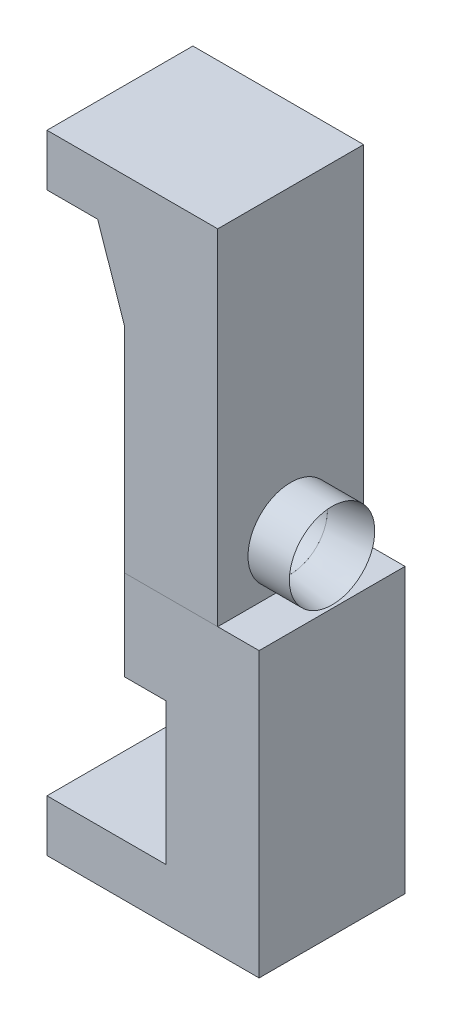
from build123d import *

# Parameters (mm, degrees)
BOSS_EXTRUDE1_DEPTH   = 7.05
BOSS_EXTRUDE1_2_DEPTH = 7.05
SKETCH3_W             = 14.1
SKETCH3_H             = 33.3
BOSS_EXTRUDE7_DEPTH   = 9
SKETCH4_R             = 3.55
CUT_EXTRUDE1_DEPTH    = 9


with BuildPart() as part:
    # Sketch1 → Revolve1 (revolve)
    with BuildSketch(Plane.XY, mode=Mode.PRIVATE) as revolve1_sk:
        Polygon((9, 4.125), (13, 4.125), (9, 3.55), align=None)
    revolve(revolve1_sk.sketch.rotate(Axis((9, 0, 0), (1, 0, 0)), 90), axis=Axis((9, 0, 0), (1, 0, 0)))


with BuildPart() as body_2:
    # Sketch2 → Boss-Extrude1 (new, symmetric)
    with BuildSketch(Plane.XY):
        Polygon((0, -4.425), (13, -4.425), (13, -31.825), (-7.5, -31.825), (-7.5, -26.825), (4, -26.825), (4, -13.125), (0, -13.125), align=None)
    extrude(amount=BOSS_EXTRUDE1_DEPTH, both=True)


with BuildPart() as body_3:
    # Sketch2 → Boss-Extrude1 2 (new, symmetric)
    with BuildSketch(Plane.XY):
        Polygon((0, 28.875), (0, 16.225), (-2.6, 23.875), (-7.5, 23.875), (-7.5, 28.875), align=None)
    extrude(amount=BOSS_EXTRUDE1_2_DEPTH, both=True)

    # Sketch3 → Boss-Extrude7 (add)
    with BuildSketch(Plane(origin=(0, 0, 0), x_dir=(0, 0, -1), z_dir=(1, 0, 0))):
        with Locations((0, 12.225)):
            Rectangle(SKETCH3_W, SKETCH3_H)
    extrude(amount=BOSS_EXTRUDE7_DEPTH)

    # Sketch4 → Cut-Extrude1 (cut)
    with BuildSketch(Plane(origin=(9, 0, 0), x_dir=(0, 0, -1), z_dir=(1, 0, 0))):
        with Locations(Location((0, 0, 0), (0, 0, 90))):
            Circle(SKETCH4_R)
    extrude(amount=-CUT_EXTRUDE1_DEPTH, mode=Mode.SUBTRACT)


solid = Compound([part.part, body_2.part, body_3.part])
